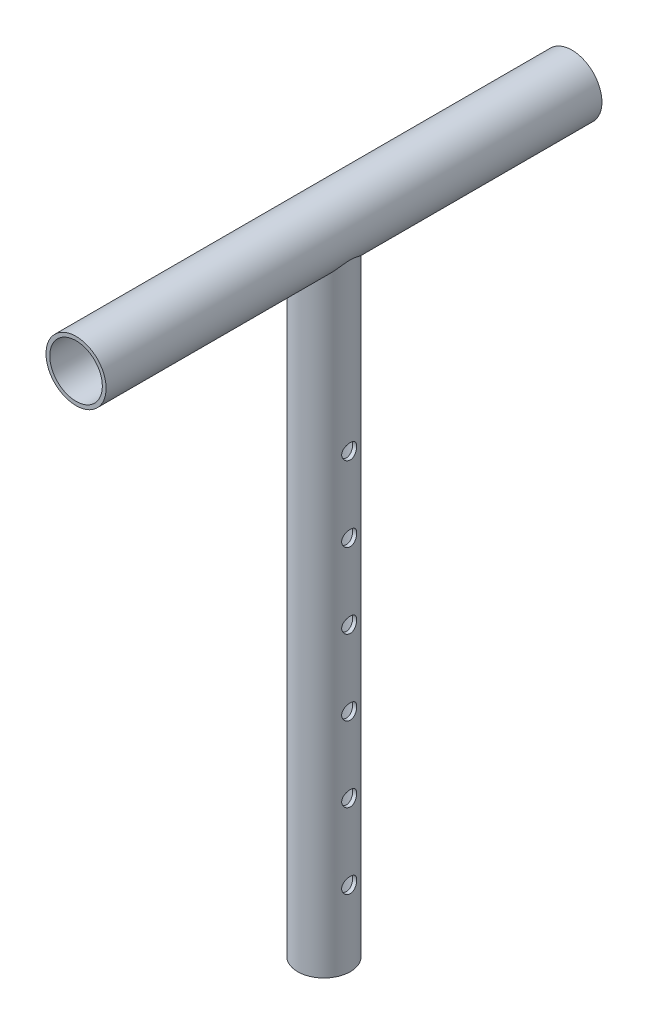
from build123d import *

# Parameters (mm, degrees)
SKETCH1_R                = 20
SKETCH1_R_2              = 17.5
BOSS_EXTRUDE1_DEPTH      = 165
BOSS_EXTRUDE2_REACH      = 472.346
BOSS_EXTRUDE2_END_RADIUS = 20
SKETCH3_R                = 17.5
SKETCH3_R_2              = 15
CUT_EXTRUDE1_DEPTH       = 452.691266377
CUT_EXTRUDE1_DEPTH_BACK  = 452.691266377
SKETCH5_R                = 5


with BuildPart() as part:
    # Sketch1 → Boss-Extrude1 (new, symmetric)
    with BuildSketch(Plane.XY):
        Circle(SKETCH1_R)
        Circle(SKETCH1_R_2, mode=Mode.SUBTRACT)
    extrude(amount=BOSS_EXTRUDE1_DEPTH, both=True)

    # Boss-Extrude2: up to this cylinder (the profile starts outside it)
    boss_extrude2_end = Plane(origin=(0, 0, 17.005025), z_dir=(0, 0, -1)) * Cylinder(BOSS_EXTRUDE2_END_RADIUS, 985.692, mode=Mode.PRIVATE)
    # Sketch3 → Boss-Extrude2 (add, up to the surface)
    with BuildSketch(Plane(origin=(0, -420, 0), x_dir=(1, 0, 0), z_dir=(0, 1, 0)), mode=Mode.PRIVATE) as boss_extrude2_sk1:
        with Locations(Location((0, 0, 0), (0, 0, 90))):
            Circle(SKETCH3_R)
        with Locations(Location((0, 0, 0), (0, 0, 90))):
            Circle(SKETCH3_R_2, mode=Mode.SUBTRACT)
    boss_extrude2_tool1 = extrude(boss_extrude2_sk1.sketch, amount=BOSS_EXTRUDE2_REACH, mode=Mode.PRIVATE) - boss_extrude2_end
    add(boss_extrude2_tool1.solids().sort_by_distance((0, -420, 17.005025))[0])

    # Sketch5 → Cut-Extrude1 (cut, two sides: drawn at the far end of the back side and taken through both)
    with BuildSketch(Plane(origin=(0, 0, 0), x_dir=(0, 0, -1), z_dir=(1, 0, 0)).offset(-CUT_EXTRUDE1_DEPTH_BACK)):
        with Locations((0, -120)):
            Circle(SKETCH5_R)
        with Locations((0, -170)):
            Circle(SKETCH5_R)
        with Locations((0, -220)):
            Circle(SKETCH5_R)
        with Locations((0, -270)):
            Circle(SKETCH5_R)
        with Locations((0, -320)):
            Circle(SKETCH5_R)
        with Locations((0, -370)):
            Circle(SKETCH5_R)
    extrude(amount=CUT_EXTRUDE1_DEPTH + CUT_EXTRUDE1_DEPTH_BACK, mode=Mode.SUBTRACT)


solid = part.part
